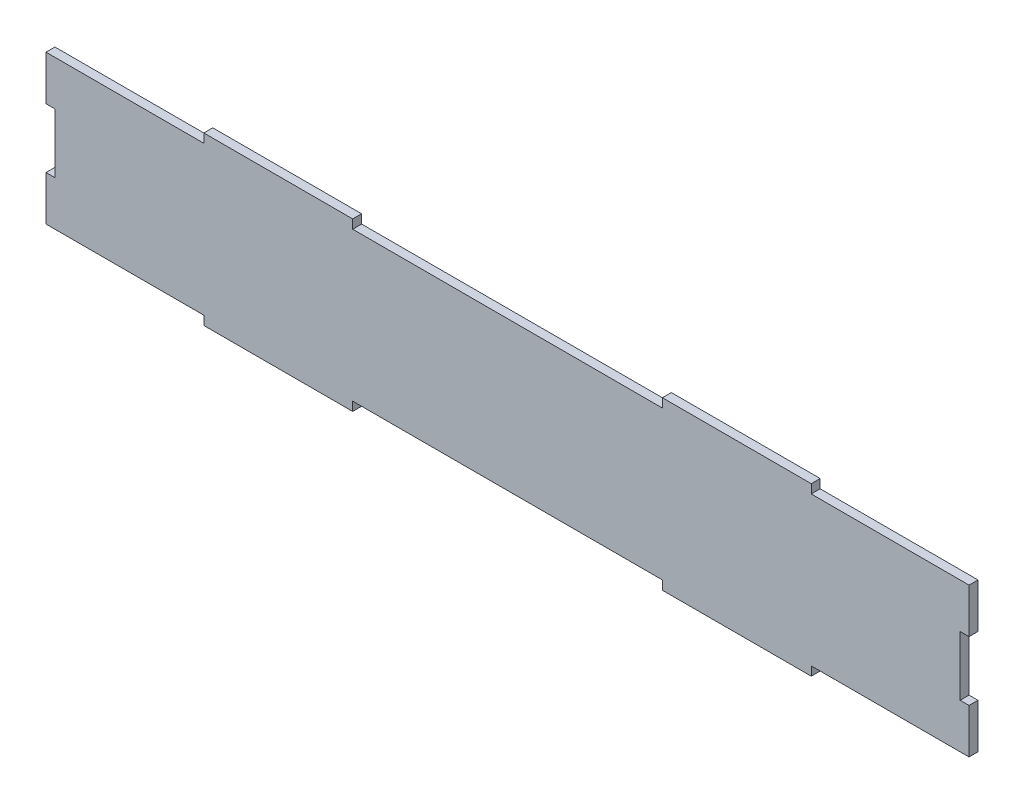
from build123d import *

# Parameters (mm, degrees)
EXTRUDE_1_DEPTH = 3


with BuildPart() as part:
    # 스케치1 → 보스-돌출1 (new body)
    with BuildSketch(Plane.XY):
        Polygon((-152, 25), (-102, 25), (-102, 28), (-52, 28), (-52, 25), (52, 25), (52, 28), (102, 28), (102, 25), (152, 25), (155, 25), (155, 10), (152, 10), (152, -10), (155, -10), (155, -25), (152, -25), (102, -25), (102, -28), (52, -28), (52, -25), (-52, -25), (-52, -28), (-102, -28), (-102, -25), (-152, -25), (-155, -25), (-155, -10), (-152, -10), (-152, 10), (-155, 10), (-155, 25), align=None)
    extrude(amount=EXTRUDE_1_DEPTH)


solid = part.part
